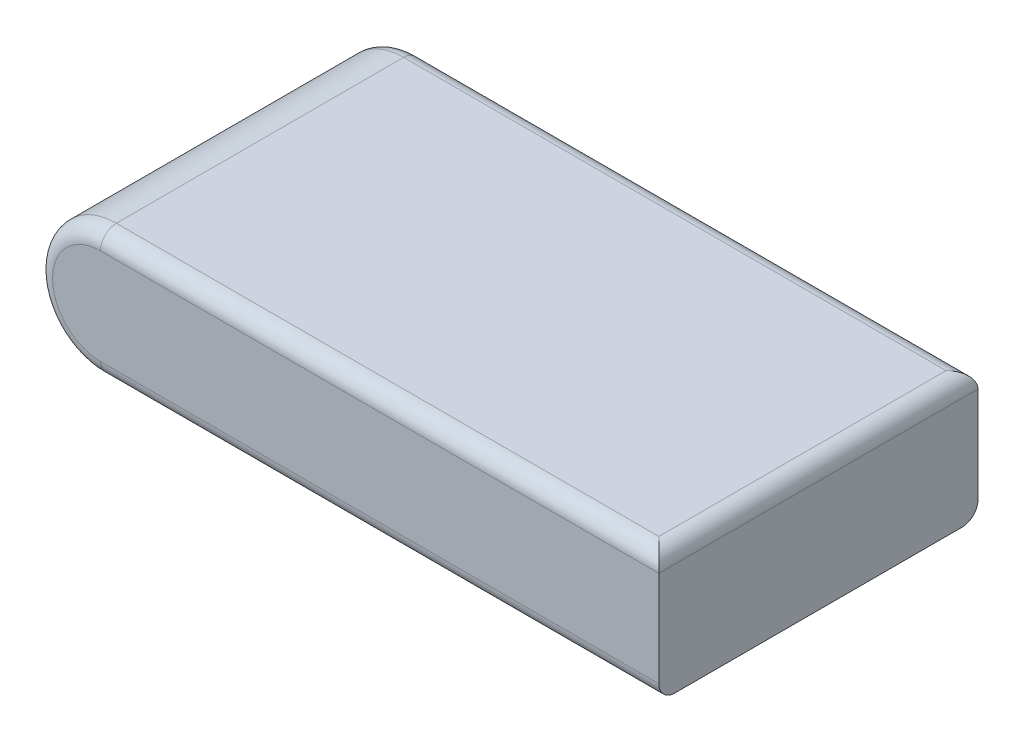
from build123d import *

# Parameters (mm, degrees)
EXTRUDE_1_DEPTH = 20
FILLET_1_R      = 1


with BuildPart() as part:
    # Эскиз1 → Бобышка-Вытянуть1 (new body)
    with BuildSketch(Plane.XY):
        with BuildLine():
            Line((17.5, -4), (-17.5, -4))
            ThreePointArc((-17.5, -4), (-21.5, 0), (-17.5, 4))
            Line((-17.5, 4), (17.5, 4))
            Line((17.5, 4), (17.5, -4))
        make_face()
    extrude(amount=EXTRUDE_1_DEPTH)

    # Скругление1
    fillet_1_edges = [part.edges().sort_by_distance(p)[0] for p in [
        (0, 4, 20),
        (-21.5, 0, 20),
        (0, 4, 0),
        (0, -4, 0),
        (-21.5, 0, 0),
        (17.5, 4, 10),
        (0, -4, 20),
    ]]
    fillet(fillet_1_edges, radius=FILLET_1_R)


solid = part.part
